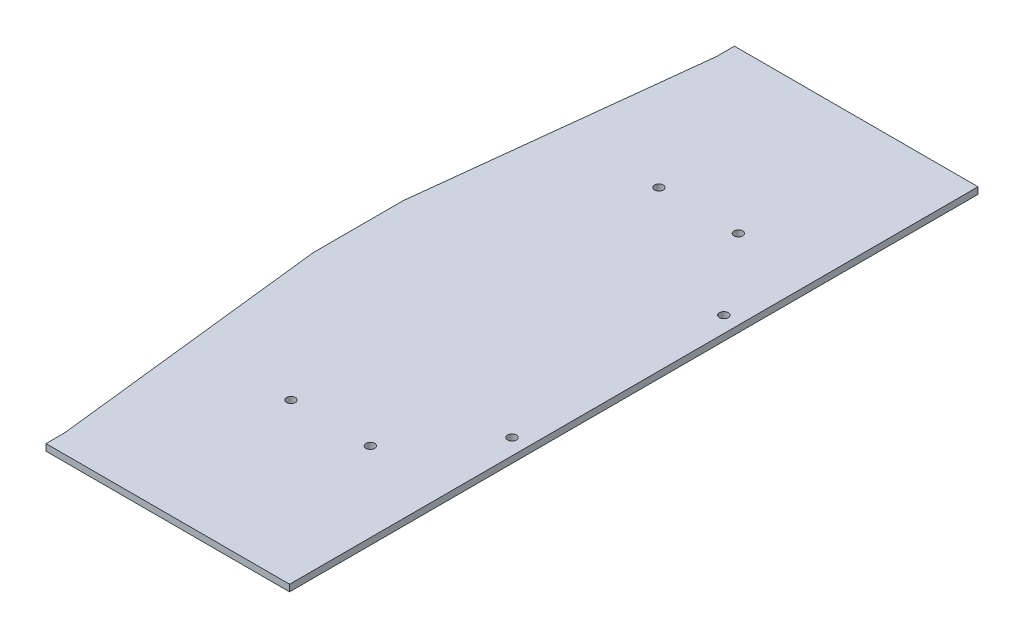
from build123d import *

# Parameters (mm, degrees)
SKETCH_1_R      = 1.65
EXTRUDE_1_DEPTH = 2.5


with BuildPart() as part:
    # 草图1 → 凸台-拉伸1 (new body)
    with BuildSketch(Plane(origin=(0, 0, 0), x_dir=(1, 0, 0), z_dir=(0, 1, 0))):
        Polygon((85.273637, -129.294264731), (135.120165849, -129.294264731), (135.120165849, 130.705735269), (85.273637, 130.705735269), (43.120165849, 130.705735269), (43.120165849, 123.705735269), (31.120165849, 17.705735269), (31.120165849, -16.294264731), (43.120165849, -122.294264731), (43.120165849, -129.294264731), align=None)
        with Locations(Location((105.120165849, 70.205735269, 0), (0, 0, 270))):
            Circle(SKETCH_1_R, mode=Mode.SUBTRACT)
        with Locations(Location((75.120165849, 70.205735269, 0), (0, 0, 270))):
            Circle(SKETCH_1_R, mode=Mode.SUBTRACT)
        with Locations(Location((75.120165849, -68.794264731, 0), (0, 0, 90))):
            Circle(SKETCH_1_R, mode=Mode.SUBTRACT)
        with Locations(Location((105.120165849, -68.794264731, 0), (0, 0, 90))):
            Circle(SKETCH_1_R, mode=Mode.SUBTRACT)
        with Locations(Location((129.120165849, 40.705735269, 0), (0, 0, 270))):
            Circle(SKETCH_1_R, mode=Mode.SUBTRACT)
        with Locations(Location((129.120165849, -39.294264731, 0), (0, 0, 90))):
            Circle(SKETCH_1_R, mode=Mode.SUBTRACT)
    extrude(amount=EXTRUDE_1_DEPTH)


solid = part.part
